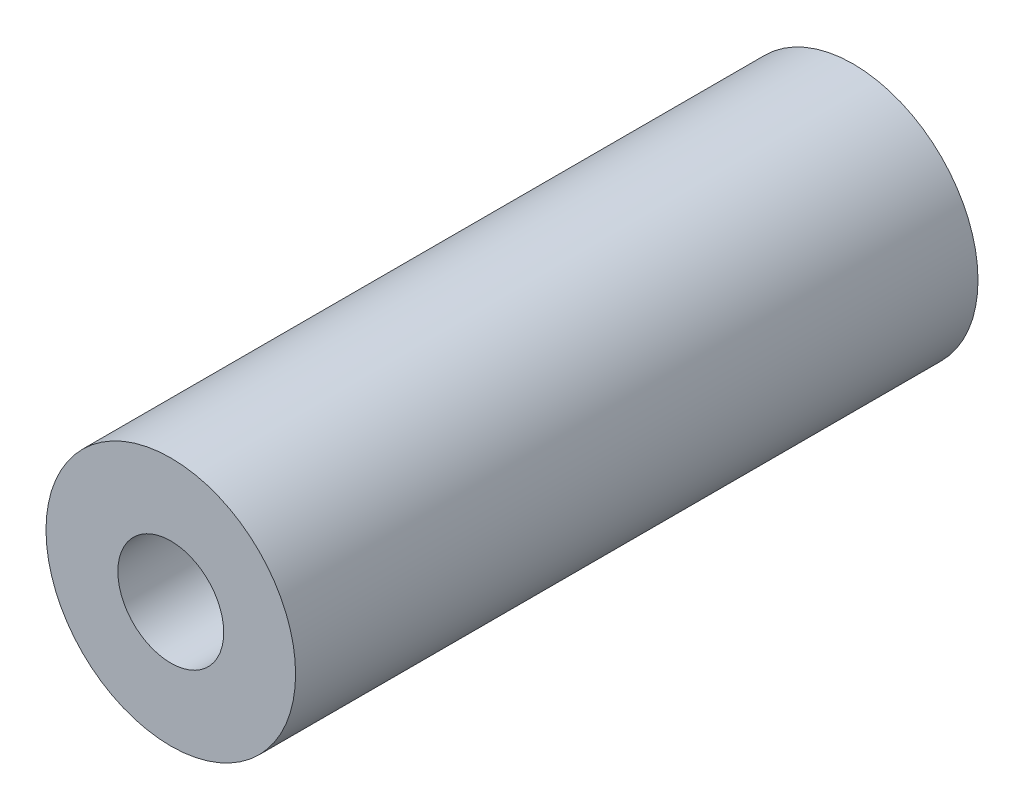
from build123d import *

# Parameters (mm, degrees)
SKETCH1_R                            = 4.7625
BOSS_EXTRUDE1_DEPTH                  = 13.02131
F_10_32_TAPPED_HOLE2_D               = 4.0386
F_10_32_TAPPED_HOLE2_DEPTH           = 15.07744
F_10_32_TAPPED_HOLE2_TIP             = 1.213317848
F_10_32_TAPPED_HOLE2_ON_FACE_2_D     = 4.0386
F_10_32_TAPPED_HOLE2_ON_FACE_2_DEPTH = 15.07744
F_10_32_TAPPED_HOLE2_ON_FACE_2_TIP   = 1.213317848


with BuildPart() as part:
    # Sketch1 → Boss-Extrude1 (new, symmetric)
    with BuildSketch(Plane.XY):
        with Locations(Location((0, 0, 0), (0, 0, 180))):
            Circle(SKETCH1_R)
    extrude(amount=BOSS_EXTRUDE1_DEPTH, both=True)

    # #10-32 Tapped Hole2
    with Locations(Plane.XY.offset(13.02131)):
        with Locations((0, 0)):
            Hole(F_10_32_TAPPED_HOLE2_D / 2, depth=F_10_32_TAPPED_HOLE2_DEPTH)
            with Locations((0, 0, -(F_10_32_TAPPED_HOLE2_DEPTH + F_10_32_TAPPED_HOLE2_TIP / 2))):  # 118° drill point
                Cone(0, F_10_32_TAPPED_HOLE2_D / 2, F_10_32_TAPPED_HOLE2_TIP, mode=Mode.SUBTRACT)

    # #10-32 Tapped Hole2 on face 2
    with Locations(Plane(origin=(0, 0, -13.02131), x_dir=(-1, 0, 0), z_dir=(0, 0, -1))):
        with Locations((0, 0)):
            Hole(F_10_32_TAPPED_HOLE2_ON_FACE_2_D / 2, depth=F_10_32_TAPPED_HOLE2_ON_FACE_2_DEPTH)
            with Locations((0, 0, -(F_10_32_TAPPED_HOLE2_ON_FACE_2_DEPTH + F_10_32_TAPPED_HOLE2_ON_FACE_2_TIP / 2))):  # 118° drill point
                Cone(0, F_10_32_TAPPED_HOLE2_ON_FACE_2_D / 2, F_10_32_TAPPED_HOLE2_ON_FACE_2_TIP, mode=Mode.SUBTRACT)


solid = part.part
